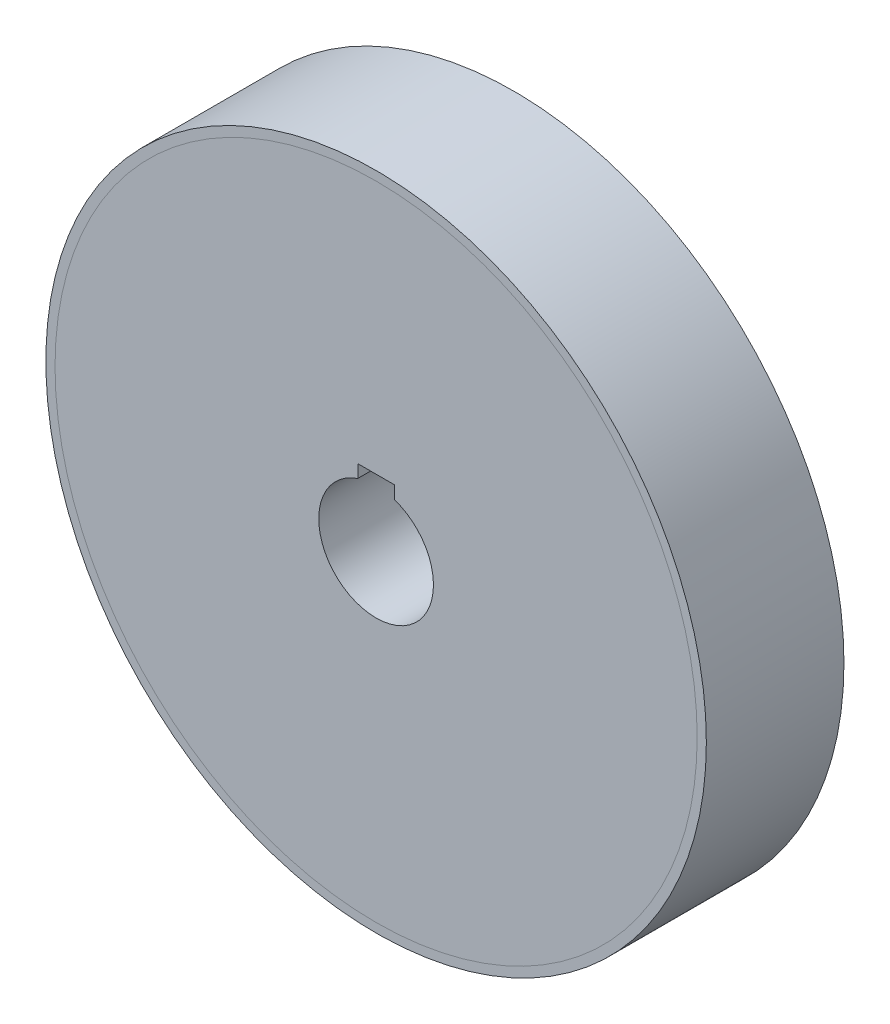
from build123d import *

# Parameters (mm, degrees)
SKETCH1_R           = 140
BOSS_EXTRUDE1_DEPTH = 60
SKETCH2_R           = 25
CUT_EXTRUDE2_DEPTH  = 207.881608656
CUT_EXTRUDE3_DEPTH  = 207.881608656
SKETCH4_R           = 144
SKETCH4_R_2         = 140
BOSS_EXTRUDE2_DEPTH = 60


with BuildPart() as part:
    # Sketch1 → Boss-Extrude1 (new body)
    with BuildSketch(Plane.XY):
        Circle(SKETCH1_R)
    extrude(amount=BOSS_EXTRUDE1_DEPTH)

    # Sketch2 → Cut-Extrude2 (cut, through all)
    with BuildSketch(Plane.XY.offset(60)):
        Circle(SKETCH2_R)
    extrude(amount=-CUT_EXTRUDE2_DEPTH, mode=Mode.SUBTRACT)

    # Sketch3 → Cut-Extrude3 (cut, through all)
    with BuildSketch(Plane.XY.offset(60)):
        with BuildLine():
            Line((-8, 23.685438565), (-8, 29.3))
            Line((-8, 29.3), (8, 29.3))
            Line((8, 29.3), (8, 23.685438565))
            ThreePointArc((8, 23.685438565), (0, 25), (-8, 23.685438565))
        make_face()
    extrude(amount=-CUT_EXTRUDE3_DEPTH, mode=Mode.SUBTRACT)


with BuildPart() as body_2:
    # Sketch4 → Boss-Extrude2 (new body)
    with BuildSketch(Plane.XY.offset(60)):
        Circle(SKETCH4_R)
        Circle(SKETCH4_R_2, mode=Mode.SUBTRACT)
    extrude(amount=-BOSS_EXTRUDE2_DEPTH)


solid = Compound([part.part, body_2.part])
